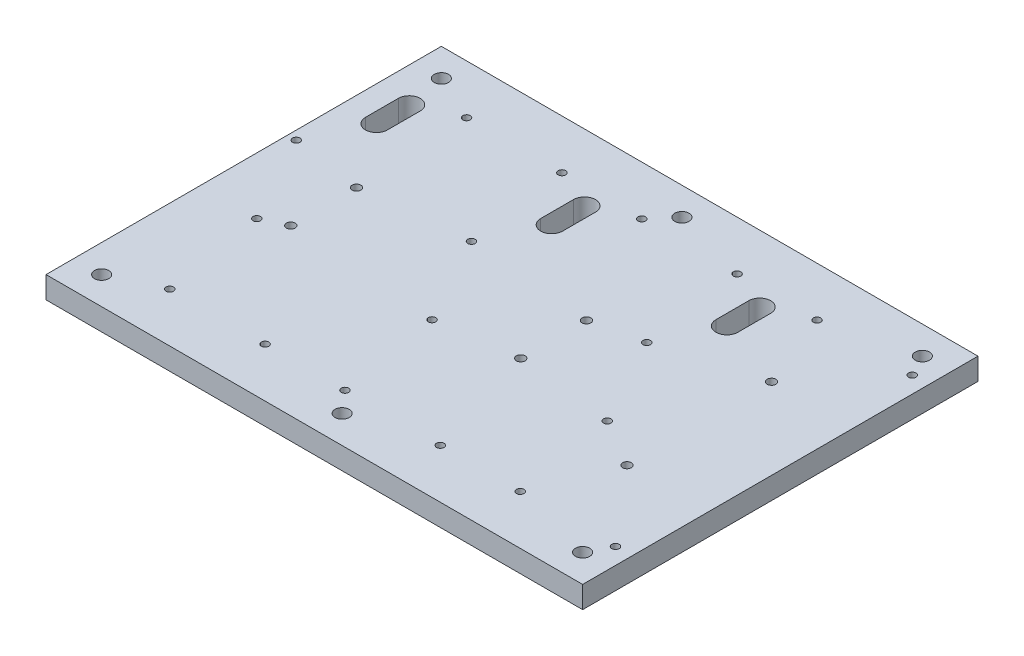
from build123d import *

# Parameters (mm, degrees)
SKETCH1_W           = 245
SKETCH1_H           = 180.5
BOSS_EXTRUDE1_DEPTH = 10
SKETCH1_5_R         = 1.7
CUT_EXTRUDE2_DEPTH  = 153.483810616
SKETCH2_W           = 120
SKETCH2_H           = 6
BOSS_EXTRUDE3_DEPTH = 30
SKETCH3_W           = 120
SKETCH3_H           = 9
BOSS_EXTRUDE4_DEPTH = 20
SKETCH4_R           = 2
CUT_EXTRUDE4_DEPTH  = 156.084855805
SKETCH7_R           = 3.25
CUT_EXTRUDE5_DEPTH  = 156.084855805
SKETCH9_R           = 1.7
CUT_EXTRUDE6_DEPTH  = 158.325498569
SKETCH10_R          = 2
CUT_EXTRUDE7_DEPTH  = 158.325498569


with BuildPart() as part:
    # Sketch1 → Boss-Extrude1 (new body)
    with BuildSketch(Plane(origin=(0, 0, 0), x_dir=(1, 0, 0), z_dir=(0, 1, 0))):
        Rectangle(SKETCH1_W, SKETCH1_H)
    extrude(amount=-BOSS_EXTRUDE1_DEPTH)

    # Sketch1<5> → Cut-Extrude2 (cut, through all)
    with BuildSketch(Plane(origin=(0, 0, 0), x_dir=(1, 0, 0), z_dir=(0, 1, 0))):
        with Locations((-88.5, 67.75)):
            Circle(SKETCH1_5_R)
        with Locations((-88.5, -67.75)):
            Circle(SKETCH1_5_R)
        with Locations((-45, -67.75)):
            Circle(SKETCH1_5_R)
        with Locations((-45, 67.75)):
            Circle(SKETCH1_5_R)
        with Locations((-8.5, 67.75)):
            Circle(SKETCH1_5_R)
        with Locations((-8.5, -67.75)):
            Circle(SKETCH1_5_R)
        with Locations((35, -67.75)):
            Circle(SKETCH1_5_R)
        with Locations((35, 67.75)):
            Circle(SKETCH1_5_R)
        with Locations((71.5, 67.75)):
            Circle(SKETCH1_5_R)
        with Locations((71.5, -67.75)):
            Circle(SKETCH1_5_R)
        with Locations((115, -67.75)):
            Circle(SKETCH1_5_R)
        with Locations((115, 67.75)):
            Circle(SKETCH1_5_R)
    extrude(amount=-CUT_EXTRUDE2_DEPTH, mode=Mode.SUBTRACT)

    # Sketch2 → Boss-Extrude3 (add)
    with BuildSketch(Plane.XZ.offset(10)):
        with Locations((-33.5, 0)):
            Rectangle(SKETCH2_W, SKETCH2_H)
    extrude(amount=BOSS_EXTRUDE3_DEPTH)

    # Sketch3 → Boss-Extrude4 (add)
    with BuildSketch(Plane.XZ.offset(10)):
        with Locations((-33.5, 0)):
            Rectangle(SKETCH3_W, SKETCH3_H)
    extrude(amount=BOSS_EXTRUDE4_DEPTH)

    # Sketch4 → Cut-Extrude4 (cut, through all)
    with BuildSketch(Plane.XZ.offset(10)):
        with Locations((-86, 15)):
            Circle(SKETCH4_R)
        with Locations((19, 15)):
            Circle(SKETCH4_R)
        with Locations((19, -15)):
            Circle(SKETCH4_R)
        with Locations((-86, -15)):
            Circle(SKETCH4_R)
    extrude(amount=-CUT_EXTRUDE4_DEPTH, mode=Mode.SUBTRACT)

    # Sketch7 → Cut-Extrude5 (cut, through all)
    with BuildSketch(Plane.XZ.offset(10)):
        with Locations((-109.8, 77.55)):
            Circle(SKETCH7_R)
        with Locations((0, 77.55)):
            Circle(SKETCH7_R)
        with Locations((109.8, 77.55)):
            Circle(SKETCH7_R)
        with Locations((-109.8, -77.55)):
            Circle(SKETCH7_R)
        with Locations((0, -77.55)):
            Circle(SKETCH7_R)
        with Locations((109.8, -77.55)):
            Circle(SKETCH7_R)
    extrude(amount=-CUT_EXTRUDE5_DEPTH, mode=Mode.SUBTRACT)

    # Sketch9 → Cut-Extrude6 (cut, through all)
    with BuildSketch(Plane(origin=(0, 0, 0), x_dir=(1, 0, 0), z_dir=(0, 1, 0))):
        with Locations((41.5, 20)):
            Circle(SKETCH9_R)
        with Locations((63.5, -20)):
            Circle(SKETCH9_R)
        with Locations((-38.5, 20)):
            Circle(SKETCH9_R)
        with Locations((-16.5, -20)):
            Circle(SKETCH9_R)
        with Locations((-118.5, 20)):
            Circle(SKETCH9_R)
        with Locations((-96.5, -20)):
            Circle(SKETCH9_R)
        with BuildLine():
            Line((58.25, 59.85), (58.25, 44.85))
            ThreePointArc((58.25, 44.85), (53.25, 39.85), (48.25, 44.85))
            Line((48.25, 44.85), (48.25, 59.85))
            ThreePointArc((48.25, 59.85), (53.25, 64.85), (58.25, 59.85))
        make_face()
        with BuildLine():
            Line((-21.75, 59.85), (-21.75, 44.85))
            ThreePointArc((-21.75, 44.85), (-26.75, 39.85), (-31.75, 44.85))
            Line((-31.75, 44.85), (-31.75, 59.85))
            ThreePointArc((-31.75, 59.85), (-26.75, 64.85), (-21.75, 59.85))
        make_face()
        with BuildLine():
            Line((-101.75, 59.85), (-101.75, 44.85))
            ThreePointArc((-101.75, 44.85), (-106.75, 39.85), (-111.75, 44.85))
            Line((-111.75, 44.85), (-111.75, 59.85))
            ThreePointArc((-111.75, 59.85), (-106.75, 64.85), (-101.75, 59.85))
        make_face()
    extrude(amount=-CUT_EXTRUDE6_DEPTH, mode=Mode.SUBTRACT)

    # Sketch10 → Cut-Extrude7 (cut, through all)
    with BuildSketch(Plane(origin=(0, 0, 0), x_dir=(1, 0, 0), z_dir=(0, 1, 0))):
        with Locations((85.5, -33)):
            Circle(SKETCH10_R)
        with Locations((85.5, 33)):
            Circle(SKETCH10_R)
    extrude(amount=-CUT_EXTRUDE7_DEPTH, mode=Mode.SUBTRACT)


solid = part.part
